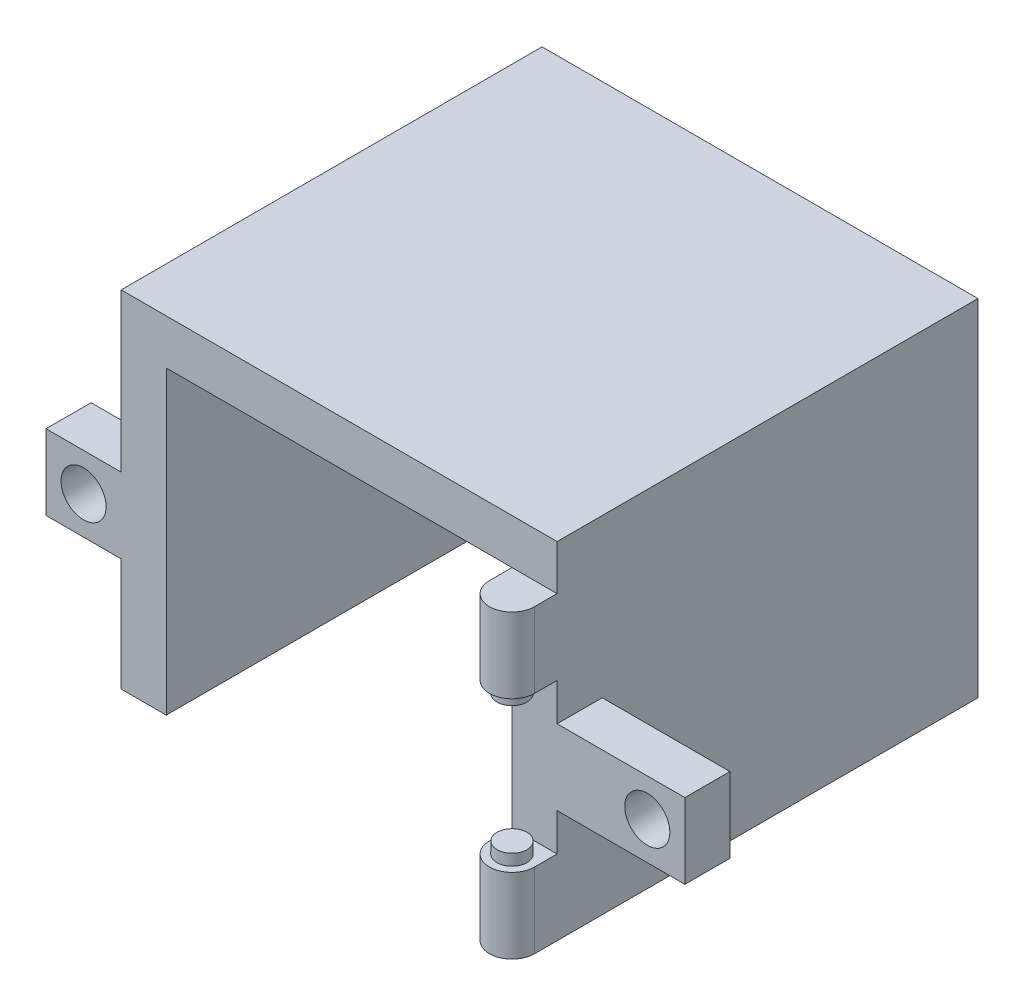
from build123d import *

# Parameters (mm, degrees)
CROQUIS1_W              = 29
CROQUIS1_H              = 28
SALIENTE_EXTRUIR1_DEPTH = 23
CROQUIS2_W              = 23
CROQUIS2_H              = 20
CORTAR_EXTRUIR1_DEPTH   = 25
SALIENTE_EXTRUIR5_DEPTH = 5
CROQUIS12_R             = 1
SALIENTE_EXTRUIR7_DEPTH = 0.75
CROQUIS13_R             = 1.5
CROQUIS13_W             = 5
CROQUIS13_H             = 5
SALIENTE_EXTRUIR8_DEPTH = 3


with BuildPart() as part:
    # Croquis1 → Saliente-Extruir1 (new body)
    with BuildSketch(Plane(origin=(0, 0, 0), x_dir=(1, 0, 0), z_dir=(0, 1, 0))):
        Rectangle(CROQUIS1_W, CROQUIS1_H)
    extrude(amount=SALIENTE_EXTRUIR1_DEPTH)

    # Croquis2 → Cortar-Extruir1 (cut)
    with BuildSketch(Plane.XY.offset(14)):
        with Locations((0, 10)):
            Rectangle(CROQUIS2_W, CROQUIS2_H)
    extrude(amount=-CORTAR_EXTRUIR1_DEPTH, mode=Mode.SUBTRACT)

    # Croquis10 → Saliente-Extruir5 (add)
    with BuildSketch(Plane.XZ):
        with BuildLine():
            Line((11.5, 14), (14.5, 14))
            Line((14.5, 14), (14.5, 15.5))
            ThreePointArc((14.5, 15.5), (13, 17), (11.5, 15.5))
            Line((11.5, 15.5), (11.5, 14))
        make_face()
    saliente_extruir5 = extrude(amount=-SALIENTE_EXTRUIR5_DEPTH)

    # Croquis12 → Saliente-Extruir7 (add)
    with BuildSketch(Plane(origin=(0, 5, 0), x_dir=(1, 0, 0), z_dir=(0, 1, 0))):
        with Locations(Location((13, -15.5, 0), (0, 0, 90))):
            Circle(CROQUIS12_R)
    saliente_extruir7 = extrude(amount=SALIENTE_EXTRUIR7_DEPTH)

    # Simetría1: Saliente-Extruir5, Saliente-Extruir7 across plane
    add(saliente_extruir5.mirror(Plane(origin=(0, 10, 0), x_dir=(0, 0, 1), z_dir=(0, -1, 0))))
    add(saliente_extruir7.mirror(Plane(origin=(0, 10, 0), x_dir=(0, 0, 1), z_dir=(0, -1, 0))))

    # Croquis13 → Saliente-Extruir8 (add)
    # profile 1 of 2: a face of its own
    with BuildSketch(Plane.XY.offset(14)):
        Polygon((18, 12.5), (23, 12.5), (23, 7.5), (18, 7.5), (14.5, 7.5), (14.5, 12.5), align=None)
        with Locations((20.5, 10)):
            Circle(CROQUIS13_R, mode=Mode.SUBTRACT)
    # profile 2 of 2: a face of its own
    with BuildSketch(Plane.XY.offset(14)):
        with Locations((-17, 10)):
            Rectangle(CROQUIS13_W, CROQUIS13_H)
        with Locations((-17, 10)):
            Circle(CROQUIS13_R, mode=Mode.SUBTRACT)
    extrude(amount=-SALIENTE_EXTRUIR8_DEPTH)


solid = part.part
